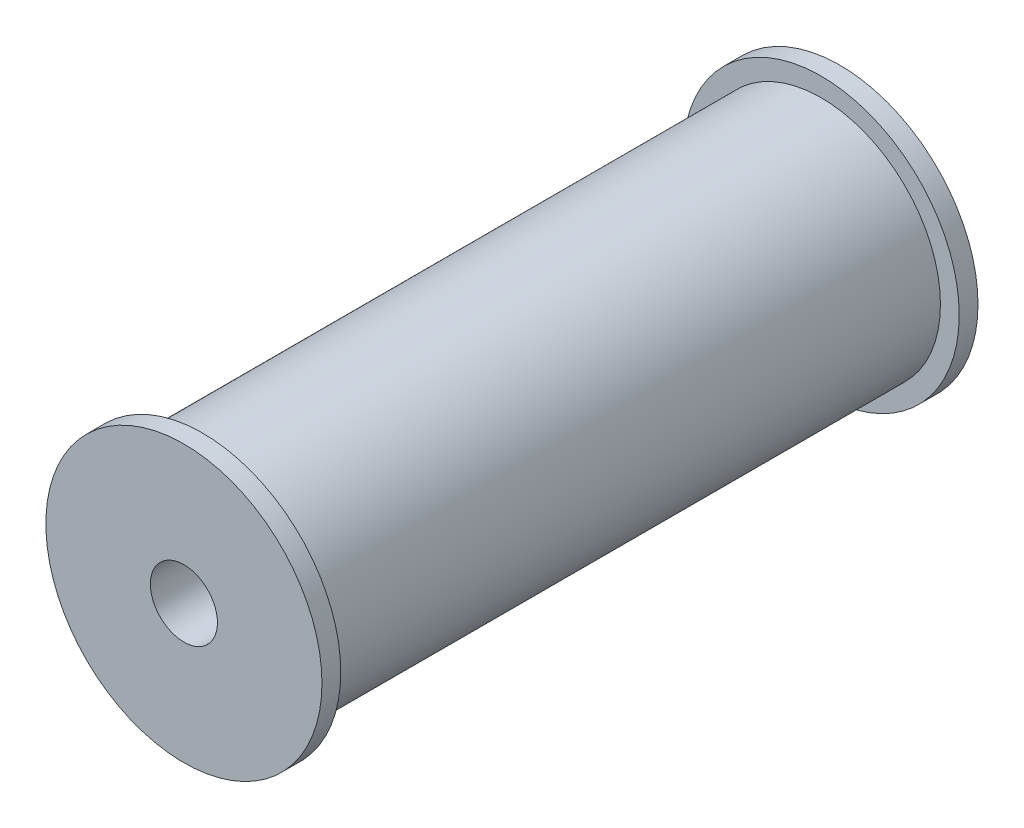
from build123d import *

# Parameters (mm, degrees)
SKETCH1_R           = 12.7
BOSS_EXTRUDE1_DEPTH = 69.85
SKETCH2_R           = 3.572
CUT_EXTRUDE3_DEPTH  = 69.85
BOSS_EXTRUDE2_START = 2
SKETCH3_R           = 14.7
SKETCH3_R_2         = 3.572
BOSS_EXTRUDE2_DEPTH = 2
BOSS_EXTRUDE3_START = 69.85
SKETCH3_2_R         = 14.7
SKETCH3_2_R_2       = 3.572
BOSS_EXTRUDE3_DEPTH = 2


with BuildPart() as part:
    # Sketch1 → Boss-Extrude1 (new body)
    with BuildSketch(Plane.XY):
        Circle(SKETCH1_R)
    extrude(amount=BOSS_EXTRUDE1_DEPTH)

    # Sketch2 → Cut-Extrude3 (cut)
    with BuildSketch(Plane.XY.offset(69.85)):
        Circle(SKETCH2_R)
    extrude(amount=-CUT_EXTRUDE3_DEPTH, mode=Mode.SUBTRACT)

    # Sketch3 → Boss-Extrude2 (add)
    with BuildSketch(Plane.XY.offset(BOSS_EXTRUDE2_START)):
        Circle(SKETCH3_R)
        Circle(SKETCH3_R_2, mode=Mode.SUBTRACT)
    extrude(amount=-BOSS_EXTRUDE2_DEPTH)

    # Sketch3<2> → Boss-Extrude3 (add)
    with BuildSketch(Plane.XY.offset(BOSS_EXTRUDE3_START)):
        Circle(SKETCH3_2_R)
        Circle(SKETCH3_2_R_2, mode=Mode.SUBTRACT)
    extrude(amount=-BOSS_EXTRUDE3_DEPTH)


solid = part.part
